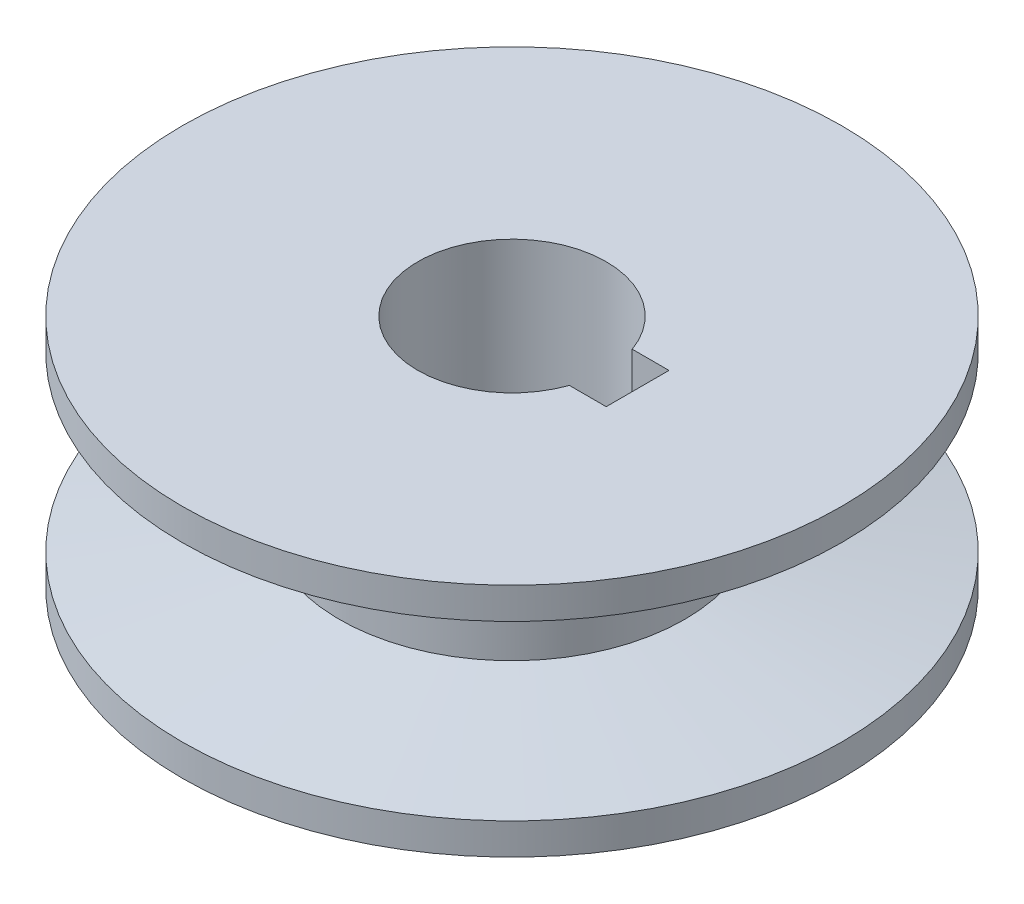
from build123d import *

# Parameters (mm, degrees)
SKETCH2_W          = 8
SKETCH2_H          = 4
CUT_EXTRUDE1_DEPTH = 15


with BuildPart() as part:
    # Sketch1 → Revolve1 (revolve)
    with BuildSketch(Plane.XY):
        Polygon((21, 5.5), (11, 3.736730193), (11, -3.736730193), (21, -5.5), (21, -7.5), (6, -7.5), (6, 7.5), (21, 7.5), align=None)
    revolve(axis=Axis((0, -1000.356754562, 0), (0, 1, 0)))

    # Sketch2 → Cut-Extrude1 (cut)
    with BuildSketch(Plane(origin=(0, 7.5, 0), x_dir=(1, 0, 0), z_dir=(0, 1, 0))):
        with Locations((4, 0)):
            Rectangle(SKETCH2_W, SKETCH2_H)
    extrude(amount=-CUT_EXTRUDE1_DEPTH, mode=Mode.SUBTRACT)


solid = part.part
